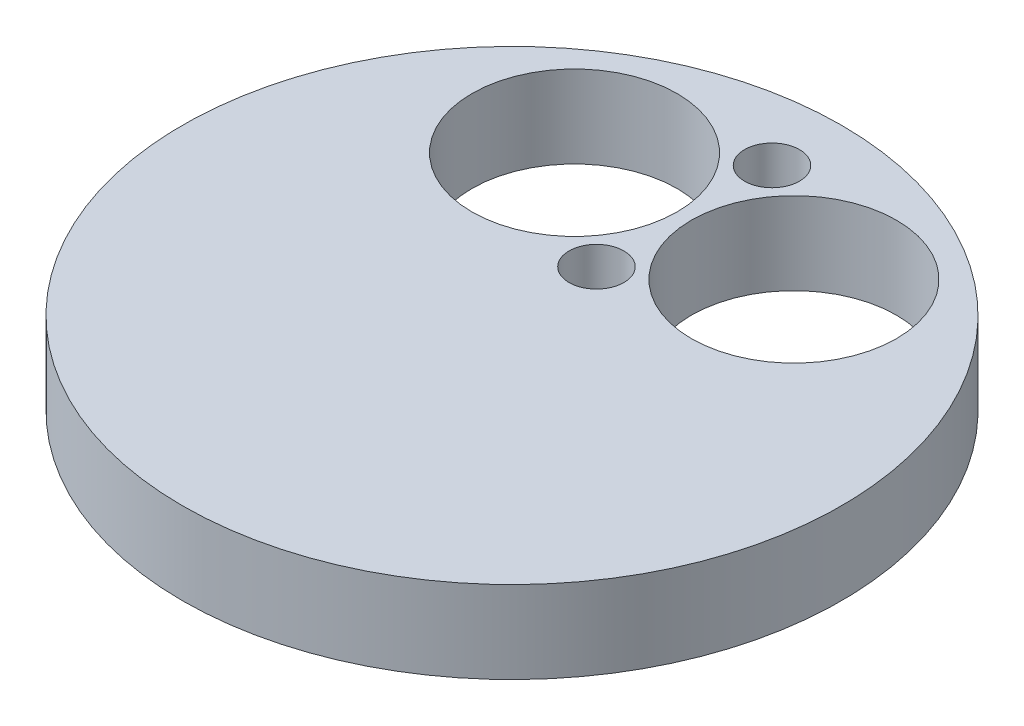
from build123d import *

# Parameters (mm, degrees)
SKETCH1_R           = 38.1508
SKETCH1_R_2         = 11.8745
SKETCH1_R_3         = 3.175
BOSS_EXTRUDE1_DEPTH = 9.525


with BuildPart() as part:
    # Sketch1 → Boss-Extrude1 (new body)
    with BuildSketch(Plane(origin=(0, 0, 0), x_dir=(1, 0, 0), z_dir=(0, 1, 0))):
        Circle(SKETCH1_R)
        with Locations((12.7, 19.939)):
            Circle(SKETCH1_R_2, mode=Mode.SUBTRACT)
        with Locations((-12.7, 19.939)):
            Circle(SKETCH1_R_2, mode=Mode.SUBTRACT)
        with Locations((0, 30.099)):
            Circle(SKETCH1_R_3, mode=Mode.SUBTRACT)
        with Locations((0, 9.779)):
            Circle(SKETCH1_R_3, mode=Mode.SUBTRACT)
    extrude(amount=BOSS_EXTRUDE1_DEPTH)


solid = part.part
